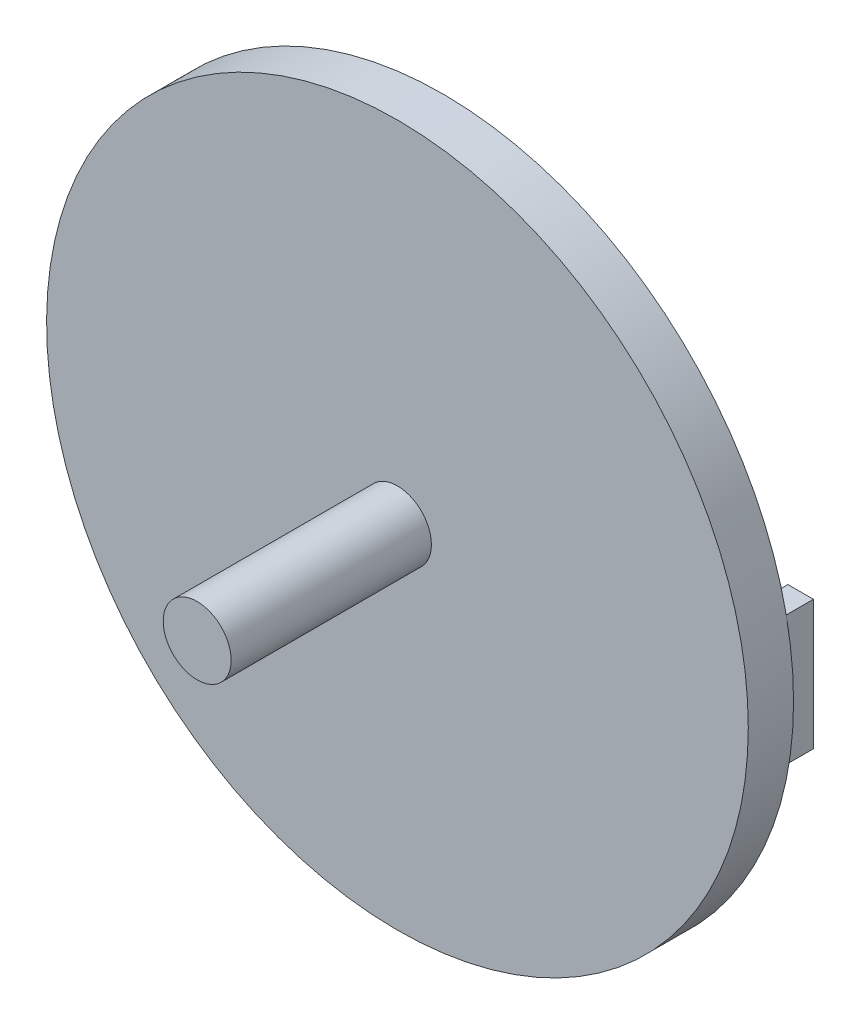
from build123d import *

# Parameters (mm, degrees)
SKETCH1_R           = 77.5
BOSS_EXTRUDE1_DEPTH = 10
SKETCH2_R           = 56.5
BOSS_EXTRUDE2_DEPTH = 5.764188233
SKETCH3_R           = 7.5
BOSS_EXTRUDE3_DEPTH = 60
SKETCH4_W           = 5.635994667
SKETCH4_H           = 28.610379267
SKETCH4_W_2         = 5.979262635
SKETCH4_H_2         = 31.399489247
BOSS_EXTRUDE4_DEPTH = 6


with BuildPart() as part:
    # Sketch1 → Boss-Extrude1 (new body)
    with BuildSketch(Plane.XY):
        Circle(SKETCH1_R)
    extrude(amount=BOSS_EXTRUDE1_DEPTH)

    # Sketch2 → Boss-Extrude2 (add)
    with BuildSketch(Plane(origin=(0, 0, 0), x_dir=(-1, 0, 0), z_dir=(0, 0, -1))):
        Circle(SKETCH2_R)
    extrude(amount=BOSS_EXTRUDE2_DEPTH)

    # Sketch3 → Boss-Extrude3 (add)
    with BuildSketch(Plane(origin=(0, 0, -5.764188233), x_dir=(-1, 0, 0), z_dir=(0, 0, -1))):
        Circle(SKETCH3_R)
    extrude(amount=-BOSS_EXTRUDE3_DEPTH)

    # Sketch4 → Boss-Extrude4 (add)
    with BuildSketch(Plane(origin=(0, 0, 0), x_dir=(-1, 0, 0), z_dir=(0, 0, -1))):
        with Locations((-73.064647, 1.445184616)):
            Rectangle(SKETCH4_W, SKETCH4_H)
        with Locations((72.742981652, 0.756905489)):
            Rectangle(SKETCH4_W_2, SKETCH4_H_2)
    extrude(amount=BOSS_EXTRUDE4_DEPTH)


solid = part.part
